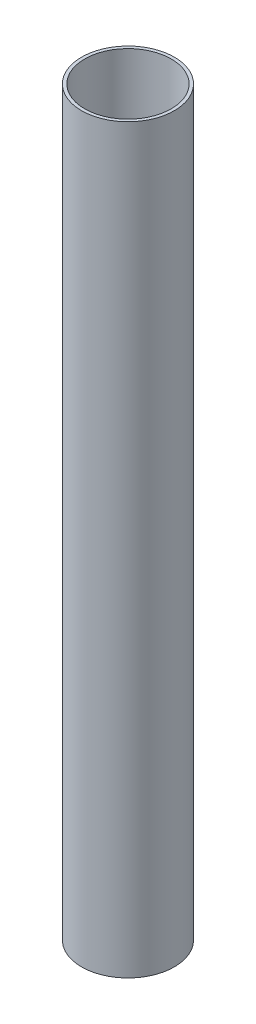
from build123d import *

# Parameters (mm, degrees)
SKETCH1_R           = 37.7
SKETCH1_R_2         = 35.15
BOSS_EXTRUDE1_DEPTH = 602.488


with BuildPart() as part:
    # Sketch1 → Boss-Extrude1 (new body)
    with BuildSketch(Plane(origin=(0, 0, 0), x_dir=(1, 0, 0), z_dir=(0, 1, 0))):
        with Locations(Location((0, 0, 0), (0, 0, 270))):
            Circle(SKETCH1_R)
        with Locations(Location((0, 0, 0), (0, 0, 270))):
            Circle(SKETCH1_R_2, mode=Mode.SUBTRACT)
    extrude(amount=BOSS_EXTRUDE1_DEPTH)


solid = part.part
